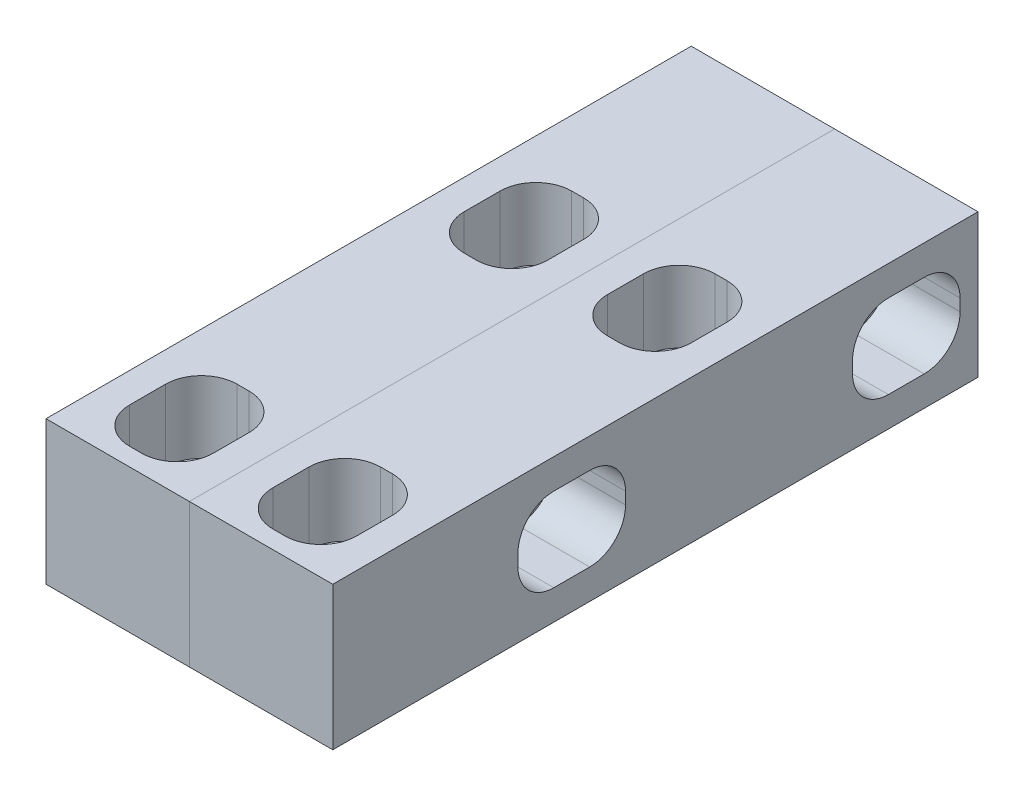
from build123d import *

# Parameters (mm, degrees)
SKETCH1_W           = 12
SKETCH1_H           = 12
BOSS_EXTRUDE1_DEPTH = 54
SKETCH2_R           = 2
CUT_EXTRUDE1_DEPTH  = 14
SKETCH3_R           = 2
CUT_EXTRUDE2_DEPTH  = 14
CUT_EXTRUDE3_DEPTH  = 6
CUT_EXTRUDE4_DEPTH  = 6


with BuildPart() as part:
    # Sketch1 → Boss-Extrude1 (new body)
    with BuildSketch(Plane.XY):
        Rectangle(SKETCH1_W, SKETCH1_H)
    extrude(amount=BOSS_EXTRUDE1_DEPTH)

    # Sketch2 → Cut-Extrude1 (cut)
    with BuildSketch(Plane(origin=(0, 6, 0), x_dir=(1, 0, 0), z_dir=(0, 1, 0))):
        with Locations(Location((0, -20, 0), (0, 0, 180))):
            Circle(SKETCH2_R)
        with Locations(Location((0, -48, 0), (0, 0, 180))):
            Circle(SKETCH2_R)
    extrude(amount=-CUT_EXTRUDE1_DEPTH, mode=Mode.SUBTRACT)

    # Sketch3 → Cut-Extrude2 (cut)
    with BuildSketch(Plane.ZY.offset(6)):
        with Locations(Location((34, 0, 0), (0, 0, 270))):
            Circle(SKETCH3_R)
        with Locations(Location((6, 0, 0), (0, 0, 270))):
            Circle(SKETCH3_R)
    extrude(amount=-CUT_EXTRUDE2_DEPTH, mode=Mode.SUBTRACT)

    # Sketch4 → Cut-Extrude3 (cut)
    with BuildSketch(Plane(origin=(6, 0, 0), x_dir=(0, 0, -1), z_dir=(1, 0, 0))):
        with BuildLine():
            Line((-4.5, -3.5), (-7.5, -3.5))
            ThreePointArc((-7.5, -3.5), (-9.621320344, -2.621320344), (-10.5, -0.5))
            Line((-10.5, -0.5), (-10.5, 0.5))
            ThreePointArc((-10.5, 0.5), (-9.621320344, 2.621320344), (-7.5, 3.5))
            Line((-7.5, 3.5), (-4.5, 3.5))
            ThreePointArc((-4.5, 3.5), (-2.378679656, 2.621320344), (-1.5, 0.5))
            Line((-1.5, 0.5), (-1.5, -0.5))
            ThreePointArc((-1.5, -0.5), (-2.378679656, -2.621320344), (-4.5, -3.5))
        make_face()
        with BuildLine():
            Line((-38.5, -0.5), (-38.5, 0.5))
            ThreePointArc((-38.5, 0.5), (-37.621320344, 2.621320344), (-35.5, 3.5))
            Line((-35.5, 3.5), (-32.5, 3.5))
            ThreePointArc((-32.5, 3.5), (-30.378679656, 2.621320344), (-29.5, 0.5))
            Line((-29.5, 0.5), (-29.5, -0.5))
            ThreePointArc((-29.5, -0.5), (-30.378679656, -2.621320344), (-32.5, -3.5))
            Line((-32.5, -3.5), (-35.5, -3.5))
            ThreePointArc((-35.5, -3.5), (-37.621320344, -2.621320344), (-38.5, -0.5))
        make_face()
    extrude(amount=-CUT_EXTRUDE3_DEPTH, mode=Mode.SUBTRACT)

    # Sketch5 → Cut-Extrude4 (cut)
    with BuildSketch(Plane(origin=(0, 6, 0), x_dir=(1, 0, 0), z_dir=(0, 1, 0))):
        with BuildLine():
            Line((-0.5, -52.5), (0.5, -52.5))
            ThreePointArc((0.5, -52.5), (2.621320344, -51.621320344), (3.5, -49.5))
            Line((3.5, -49.5), (3.5, -46.5))
            ThreePointArc((3.5, -46.5), (2.621320344, -44.378679656), (0.5, -43.5))
            Line((0.5, -43.5), (-0.5, -43.5))
            ThreePointArc((-0.5, -43.5), (-2.621320344, -44.378679656), (-3.5, -46.5))
            Line((-3.5, -46.5), (-3.5, -49.5))
            ThreePointArc((-3.5, -49.5), (-2.621320344, -51.621320344), (-0.5, -52.5))
        make_face()
        with BuildLine():
            Line((-0.5, -24.5), (0.5, -24.5))
            ThreePointArc((0.5, -24.5), (2.621320344, -23.621320344), (3.5, -21.5))
            Line((3.5, -21.5), (3.5, -18.5))
            ThreePointArc((3.5, -18.5), (2.621320344, -16.378679656), (0.5, -15.5))
            Line((0.5, -15.5), (-0.5, -15.5))
            ThreePointArc((-0.5, -15.5), (-2.621320344, -16.378679656), (-3.5, -18.5))
            Line((-3.5, -18.5), (-3.5, -21.5))
            ThreePointArc((-3.5, -21.5), (-2.621320344, -23.621320344), (-0.5, -24.5))
        make_face()
    extrude(amount=-CUT_EXTRUDE4_DEPTH, mode=Mode.SUBTRACT)


with BuildPart() as body_2:
    # Mirror3: mirrored copy
    add(part.part.mirror(Plane(origin=(-6, 6, 54), x_dir=(0, 0, 1), z_dir=(1, 0, 0))))


solid = Compound([part.part, body_2.part])
